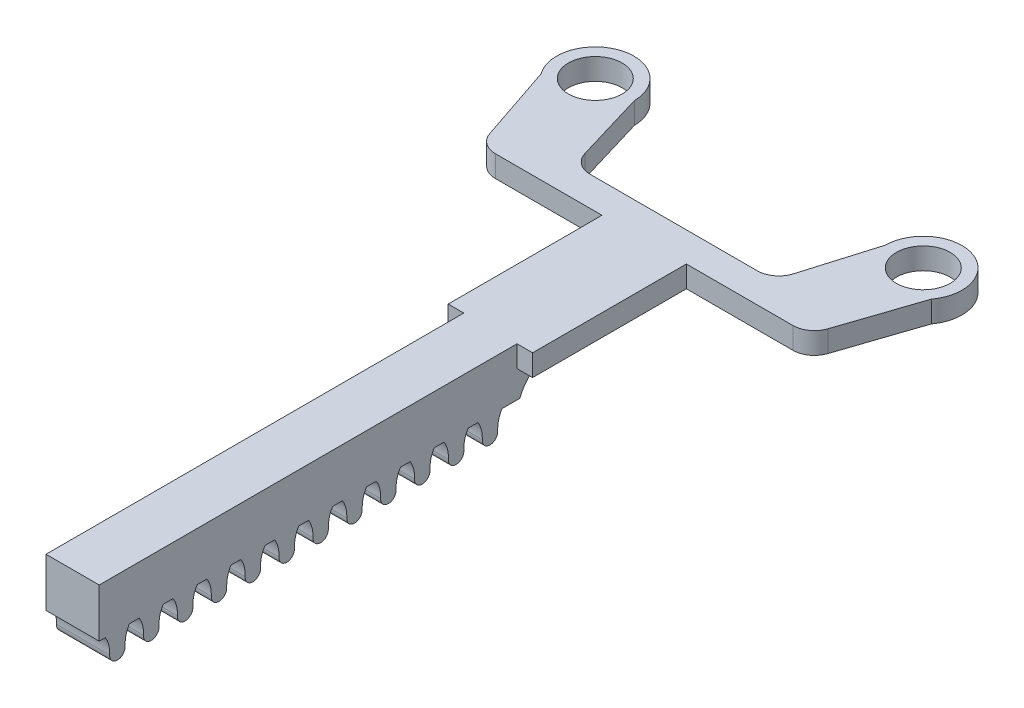
from build123d import *

# Parameters (mm, degrees)
SKETCH1_R           = 0.5
BOSS_EXTRUDE1_DEPTH = 0.4
SKETCH2_W           = 0.99
SKETCH2_H           = 7.77
BOSS_EXTRUDE2_DEPTH = 1
CUT_EXTRUDE1_DEPTH  = 1
SKETCH6_W           = 0.99
SKETCH6_H           = 0.8
BOSS_EXTRUDE3_DEPTH = 1
SKETCH7_R           = 0.809129623
CUT_EXTRUDE3_DEPTH  = 1
CUT_EXTRUDE4_DEPTH  = 1
CUT_EXTRUDE5_DEPTH  = 1


with BuildPart() as part:
    # Sketch1 → Boss-Extrude1 (new body)
    # profile 1 of 2: a face of its own
    with BuildSketch(Plane(origin=(0, 0, 0), x_dir=(1, 0, 0), z_dir=(0, 1, 0))):
        with BuildLine():
            Line((0.495, 0), (0.495, -7.77))
            Line((0.495, -7.77), (0.99, -7.77))
            Line((0.99, -7.77), (0.99, 0))
            Line((0.99, 0), (1.28, 0))
            Line((1.28, 0), (1.28, 2.86))
            Line((1.28, 2.86), (3.26, 2.86))
            ThreePointArc((3.26, 2.86), (3.493401063, 2.935155509), (3.639095249, 3.132380282))
            Line((3.639095249, 3.132380282), (4.124050177, 4.572942227))
            ThreePointArc((4.124050177, 4.572942227), (3.773991754, 5.683797022), (2.825140446, 5.008356078))
            Line((2.825140446, 5.008356078), (2.433289117, 3.695590853))
            ThreePointArc((2.433289117, 3.695590853), (2.288994081, 3.489248025), (2.05, 3.41))
            Line((2.05, 3.41), (1.28, 3.41))
            Line((1.28, 3.41), (0.495, 3.41))
            Line((0.495, 3.41), (0.495, 2.86))
            Line((0.495, 2.86), (0.495, 0))
        make_face()
        with Locations(Location((3.545140446, 5.001096664, 0), (0, 0, 270))):
            Circle(SKETCH1_R, mode=Mode.SUBTRACT)
    # profile 2 of 2: a face of its own
    with BuildSketch(Plane(origin=(0, 0, 0), x_dir=(1, 0, 0), z_dir=(0, 1, 0))):
        with BuildLine():
            Line((-2.27, 2.86), (-0.29, 2.86))
            Line((-0.29, 2.86), (-0.29, 0))
            Line((-0.29, 0), (0, 0))
            Line((0, 0), (0, -7.77))
            Line((0, -7.77), (0.495, -7.77))
            Line((0.495, -7.77), (0.495, 0))
            Line((0.495, 0), (0.495, 2.86))
            Line((0.495, 2.86), (0.495, 3.41))
            Line((0.495, 3.41), (-0.29, 3.41))
            Line((-0.29, 3.41), (-1.06, 3.41))
            ThreePointArc((-1.06, 3.41), (-1.298994081, 3.489248025), (-1.443289117, 3.695590853))
            Line((-1.443289117, 3.695590853), (-1.835140446, 5.008356078))
            ThreePointArc((-1.835140446, 5.008356078), (-2.783991754, 5.683797022), (-3.134050177, 4.572942227))
            Line((-3.134050177, 4.572942227), (-2.649095249, 3.132380282))
            ThreePointArc((-2.649095249, 3.132380282), (-2.503401063, 2.935155509), (-2.27, 2.86))
        make_face()
        with Locations(Location((-2.555140446, 5.001096664, 0), (0, 0, 270))):
            Circle(SKETCH1_R, mode=Mode.SUBTRACT)
    extrude(amount=BOSS_EXTRUDE1_DEPTH)

    # Sketch2 → Boss-Extrude2 (add)
    with BuildSketch(Plane.XZ):
        with Locations((0.495, 3.885)):
            Rectangle(SKETCH2_W, SKETCH2_H)
    extrude(amount=BOSS_EXTRUDE2_DEPTH)

    # Sketch5 → Cut-Extrude1 (cut)
    with BuildSketch(Plane.ZY):
        with BuildLine():
            ThreePointArc((7.575547609, -0.835332211), (7.432352405, -0.978527415), (7.289157201, -0.835332211))
            Line((7.289157201, -0.835332211), (7.289157201, -0.771041274))
            add(Edge.make_bspline(
                [(7.289157201, -0.771041274), (7.282098778, -0.622016662), (7.208094318, -0.505412251)],
                knots=[0.13405431, 0.13405431, 0.13405431, 0.769777422, 0.769777422, 0.769777422], degree=2))
            Line((7.208094318, -0.505412251), (7.150068787, -0.505412251))
            Line((7.150068787, -0.505412251), (7.026610492, -0.505412251))
            add(Edge.make_bspline(
                [(6.945136285, -0.824486473), (6.939585005, -0.642533117), (7.026610492, -0.505412251)],
                knots=[0.022199322, 0.022199322, 0.022199322, 0.769777422, 0.769777422, 0.769777422], degree=2))
            ThreePointArc((6.945136285, -0.824486473), (6.945444741, -0.829905444), (6.945547609, -0.835332211))
            ThreePointArc((6.945547609, -0.835332211), (6.802352405, -0.978527415), (6.659157201, -0.835332211))
            ThreePointArc((6.659157201, -0.835332211), (6.659260069, -0.829905444), (6.659568525, -0.824486473))
            add(Edge.make_bspline(
                [(6.659568525, -0.824486473), (6.665119805, -0.642533117), (6.578094318, -0.505412251)],
                knots=[0.022199322, 0.022199322, 0.022199322, 0.769777422, 0.769777422, 0.769777422], degree=2))
            Line((6.578094318, -0.505412251), (6.520068787, -0.505412251))
            Line((6.520068787, -0.505412251), (6.454636023, -0.505412251))
            Line((6.454636023, -0.505412251), (6.396610492, -0.505412251))
            add(Edge.make_bspline(
                [(6.315136285, -0.824486473), (6.309585005, -0.642533117), (6.396610492, -0.505412251)],
                knots=[0.022199322, 0.022199322, 0.022199322, 0.769777422, 0.769777422, 0.769777422], degree=2))
            ThreePointArc((6.315136285, -0.824486473), (6.315444741, -0.829905444), (6.315547609, -0.835332211))
            ThreePointArc((6.315547609, -0.835332211), (6.172352405, -0.978527415), (6.029157201, -0.835332211))
            ThreePointArc((6.029157201, -0.835332211), (6.029260069, -0.829905444), (6.029568525, -0.824486473))
            add(Edge.make_bspline(
                [(6.029568525, -0.824486473), (6.035119805, -0.642533117), (5.948094318, -0.505412251)],
                knots=[0.022199322, 0.022199322, 0.022199322, 0.769777422, 0.769777422, 0.769777422], degree=2))
            Line((5.948094318, -0.505412251), (5.890068787, -0.505412251))
            Line((5.890068787, -0.505412251), (5.824636023, -0.505412251))
            Line((5.824636023, -0.505412251), (5.766610492, -0.505412251))
            add(Edge.make_bspline(
                [(5.685136285, -0.824486473), (5.679585005, -0.642533117), (5.766610492, -0.505412251)],
                knots=[0.022199322, 0.022199322, 0.022199322, 0.769777422, 0.769777422, 0.769777422], degree=2))
            ThreePointArc((5.685136285, -0.824486473), (5.685444741, -0.829905444), (5.685547609, -0.835332211))
            ThreePointArc((5.685547609, -0.835332211), (5.542352405, -0.978527415), (5.399157201, -0.835332211))
            ThreePointArc((5.399157201, -0.835332211), (5.399260069, -0.829905444), (5.399568525, -0.824486473))
            add(Edge.make_bspline(
                [(5.399568525, -0.824486473), (5.405119805, -0.642533117), (5.318094318, -0.505412251)],
                knots=[0.022199322, 0.022199322, 0.022199322, 0.769777422, 0.769777422, 0.769777422], degree=2))
            Line((5.318094318, -0.505412251), (5.260068787, -0.505412251))
            Line((5.260068787, -0.505412251), (5.194636023, -0.505412251))
            Line((5.194636023, -0.505412251), (5.136610492, -0.505412251))
            add(Edge.make_bspline(
                [(5.055136285, -0.824486473), (5.049585005, -0.642533117), (5.136610492, -0.505412251)],
                knots=[0.022199322, 0.022199322, 0.022199322, 0.769777422, 0.769777422, 0.769777422], degree=2))
            ThreePointArc((5.055136285, -0.824486473), (5.055444741, -0.829905444), (5.055547609, -0.835332211))
            ThreePointArc((5.055547609, -0.835332211), (4.912352405, -0.978527415), (4.769157201, -0.835332211))
            ThreePointArc((4.769157201, -0.835332211), (4.769260069, -0.829905444), (4.769568525, -0.824486473))
            add(Edge.make_bspline(
                [(4.769568525, -0.824486473), (4.775119805, -0.642533117), (4.688094318, -0.505412251)],
                knots=[0.022199322, 0.022199322, 0.022199322, 0.769777422, 0.769777422, 0.769777422], degree=2))
            Line((4.688094318, -0.505412251), (4.630068787, -0.505412251))
            Line((4.630068787, -0.505412251), (4.564636023, -0.505412251))
            Line((4.564636023, -0.505412251), (4.506610492, -0.505412251))
            add(Edge.make_bspline(
                [(4.425136285, -0.824486473), (4.419585005, -0.642533117), (4.506610492, -0.505412251)],
                knots=[0.022199322, 0.022199322, 0.022199322, 0.769777422, 0.769777422, 0.769777422], degree=2))
            ThreePointArc((4.425136285, -0.824486473), (4.425444741, -0.829905444), (4.425547609, -0.835332211))
            ThreePointArc((4.425547609, -0.835332211), (4.282352405, -0.978527415), (4.139157201, -0.835332211))
            ThreePointArc((4.139157201, -0.835332211), (4.139260069, -0.829905444), (4.139568525, -0.824486473))
            add(Edge.make_bspline(
                [(4.139568525, -0.824486473), (4.145119805, -0.642533117), (4.058094318, -0.505412251)],
                knots=[0.022199322, 0.022199322, 0.022199322, 0.769777422, 0.769777422, 0.769777422], degree=2))
            Line((4.058094318, -0.505412251), (4.000068787, -0.505412251))
            Line((4.000068787, -0.505412251), (3.934636023, -0.505412251))
            Line((3.934636023, -0.505412251), (3.876610492, -0.505412251))
            add(Edge.make_bspline(
                [(3.795136285, -0.824486473), (3.789585005, -0.642533117), (3.876610492, -0.505412251)],
                knots=[0.022199322, 0.022199322, 0.022199322, 0.769777422, 0.769777422, 0.769777422], degree=2))
            ThreePointArc((3.795136285, -0.824486473), (3.795444741, -0.829905444), (3.795547609, -0.835332211))
            ThreePointArc((3.795547609, -0.835332211), (3.652352405, -0.978527415), (3.509157201, -0.835332211))
            ThreePointArc((3.509157201, -0.835332211), (3.509260069, -0.829905444), (3.509568525, -0.824486473))
            add(Edge.make_bspline(
                [(3.509568525, -0.824486473), (3.515119805, -0.642533117), (3.428094318, -0.505412251)],
                knots=[0.022199322, 0.022199322, 0.022199322, 0.769777422, 0.769777422, 0.769777422], degree=2))
            Line((3.428094318, -0.505412251), (3.370068787, -0.505412251))
            Line((3.370068787, -0.505412251), (3.304636023, -0.505412251))
            Line((3.304636023, -0.505412251), (3.246610492, -0.505412251))
            add(Edge.make_bspline(
                [(3.165136285, -0.824486473), (3.159585005, -0.642533117), (3.246610492, -0.505412251)],
                knots=[0.022199322, 0.022199322, 0.022199322, 0.769777422, 0.769777422, 0.769777422], degree=2))
            ThreePointArc((3.165136285, -0.824486473), (3.165444741, -0.829905444), (3.165547609, -0.835332211))
            ThreePointArc((3.165547609, -0.835332211), (3.022352405, -0.978527415), (2.879157201, -0.835332211))
            ThreePointArc((2.879157201, -0.835332211), (2.879260069, -0.829905444), (2.879568525, -0.824486473))
            add(Edge.make_bspline(
                [(2.879568525, -0.824486473), (2.885119805, -0.642533117), (2.798094318, -0.505412251)],
                knots=[0.022199322, 0.022199322, 0.022199322, 0.769777422, 0.769777422, 0.769777422], degree=2))
            Line((2.798094318, -0.505412251), (2.740068787, -0.505412251))
            Line((2.740068787, -0.505412251), (2.674636023, -0.505412251))
            Line((2.674636023, -0.505412251), (2.616610492, -0.505412251))
            add(Edge.make_bspline(
                [(2.535136285, -0.824486473), (2.529585005, -0.642533117), (2.616610492, -0.505412251)],
                knots=[0.022199322, 0.022199322, 0.022199322, 0.769777422, 0.769777422, 0.769777422], degree=2))
            ThreePointArc((2.535136285, -0.824486473), (2.535444741, -0.829905444), (2.535547609, -0.835332211))
            ThreePointArc((2.535547609, -0.835332211), (2.392352405, -0.978527415), (2.249157201, -0.835332211))
            ThreePointArc((2.249157201, -0.835332211), (2.249260069, -0.829905444), (2.249568525, -0.824486473))
            add(Edge.make_bspline(
                [(2.249568525, -0.824486473), (2.255119805, -0.642533117), (2.168094318, -0.505412251)],
                knots=[0.022199322, 0.022199322, 0.022199322, 0.769777422, 0.769777422, 0.769777422], degree=2))
            Line((2.168094318, -0.505412251), (2.110068787, -0.505412251))
            Line((2.110068787, -0.505412251), (2.044636023, -0.505412251))
            Line((2.044636023, -0.505412251), (1.986610492, -0.505412251))
            add(Edge.make_bspline(
                [(1.905136285, -0.824486473), (1.899585005, -0.642533117), (1.986610492, -0.505412251)],
                knots=[0.022199322, 0.022199322, 0.022199322, 0.769777422, 0.769777422, 0.769777422], degree=2))
            ThreePointArc((1.905136285, -0.824486473), (1.905444741, -0.829905444), (1.905547609, -0.835332211))
            ThreePointArc((1.905547609, -0.835332211), (1.762352405, -0.978527415), (1.619157201, -0.835332211))
            ThreePointArc((1.619157201, -0.835332211), (1.619260069, -0.829905444), (1.619568525, -0.824486473))
            add(Edge.make_bspline(
                [(1.619568525, -0.824486473), (1.625119805, -0.642533117), (1.538094318, -0.505412251)],
                knots=[0.022199322, 0.022199322, 0.022199322, 0.769777422, 0.769777422, 0.769777422], degree=2))
            Line((1.538094318, -0.505412251), (1.480068787, -0.505412251))
            Line((1.480068787, -0.505412251), (1.414636023, -0.505412251))
            Line((1.414636023, -0.505412251), (1.356610492, -0.505412251))
            add(Edge.make_bspline(
                [(1.275136285, -0.824486473), (1.269585005, -0.642533117), (1.356610492, -0.505412251)],
                knots=[0.022199322, 0.022199322, 0.022199322, 0.769777422, 0.769777422, 0.769777422], degree=2))
            ThreePointArc((1.275136285, -0.824486473), (1.275444741, -0.829905444), (1.275547609, -0.835332211))
            ThreePointArc((1.275547609, -0.835332211), (1.132352405, -0.978527415), (0.989157201, -0.835332211))
            ThreePointArc((0.989157201, -0.835332211), (0.989260069, -0.829905444), (0.989568525, -0.824486473))
            add(Edge.make_bspline(
                [(0.989568525, -0.824486473), (0.995119805, -0.642533117), (0.908094318, -0.505412251)],
                knots=[0.022199322, 0.022199322, 0.022199322, 0.769777422, 0.769777422, 0.769777422], degree=2))
            Line((0.908094318, -0.505412251), (0.850068787, -0.505412251))
            Line((0.850068787, -0.505412251), (0.784636023, -0.505412251))
            Line((0.784636023, -0.505412251), (0.726610492, -0.505412251))
            add(Edge.make_bspline(
                [(0.645136285, -0.824486473), (0.639585005, -0.642533117), (0.726610492, -0.505412251)],
                knots=[0.022199322, 0.022199322, 0.022199322, 0.769777422, 0.769777422, 0.769777422], degree=2))
            ThreePointArc((0.645136285, -0.824486473), (0.645444741, -0.829905444), (0.645547609, -0.835332211))
            ThreePointArc((0.645547609, -0.835332211), (0.502352405, -0.978527415), (0.359157201, -0.835332211))
            ThreePointArc((0.359157201, -0.835332211), (0.359260069, -0.829905444), (0.359568525, -0.824486473))
            add(Edge.make_bspline(
                [(0.359568525, -0.824486473), (0.365119805, -0.642533117), (0.278094318, -0.505412251)],
                knots=[0.022199322, 0.022199322, 0.022199322, 0.769777422, 0.769777422, 0.769777422], degree=2))
            Line((0.278094318, -0.505412251), (0.154636023, -0.505412251))
            Line((0.154636023, -0.505412251), (-0.098714184, -1.20159072))
            Line((-0.098714184, -1.20159072), (7.934168226, -1.20159072))
            Line((7.934168226, -1.20159072), (7.780068787, -0.505412251))
            Line((7.780068787, -0.505412251), (7.656610492, -0.505412251))
            add(Edge.make_bspline(
                [(7.575136285, -0.824486473), (7.569585005, -0.642533117), (7.656610492, -0.505412251)],
                knots=[0.022199322, 0.022199322, 0.022199322, 0.769777422, 0.769777422, 0.769777422], degree=2))
            ThreePointArc((7.575136285, -0.824486473), (7.575444741, -0.829905444), (7.575547609, -0.835332211))
        make_face()
    extrude(amount=-CUT_EXTRUDE1_DEPTH, mode=Mode.SUBTRACT)

    # Sketch6 → Boss-Extrude3 (add)
    with BuildSketch(Plane.XZ):
        with Locations((0.495, -0.4)):
            Rectangle(SKETCH6_W, SKETCH6_H)
    extrude(amount=BOSS_EXTRUDE3_DEPTH)

    # Sketch7 → Cut-Extrude3 (cut)
    with BuildSketch(Plane.ZY):
        with Locations((-0.8, -0.809129623)):
            Circle(SKETCH7_R)
    extrude(amount=-CUT_EXTRUDE3_DEPTH, mode=Mode.SUBTRACT)


with BuildPart() as cut_extrude3_piece_1:
    # of the separate pieces the step leaves, piece 1, a body of its own (cut_extrude3_pieces)
    add(part.part.solids().sort_by_distance((0.99, 0.4, 7.77))[0])

    # Sketch9 → Cut-Extrude5 (cut)
    with BuildSketch(Plane.ZY):
        Polygon((0.154636023, -0.505412251), (-0.050035664, -0.505412251), (0, -0.930335013), align=None)
    extrude(amount=-CUT_EXTRUDE5_DEPTH, mode=Mode.SUBTRACT)


with BuildPart() as cut_extrude3_piece_2:
    # of the separate pieces the step leaves, piece 2, a body of its own (cut_extrude3_pieces)
    add(part.part.solids().sort_by_distance((0, -1, 0))[0])

    # Sketch8 → Cut-Extrude4 (cut)
    with BuildSketch(Plane.ZY):
        Polygon((0, -1), (-0.01370537, -1), (0, -0.930335013), align=None)
    extrude(amount=-CUT_EXTRUDE4_DEPTH, mode=Mode.SUBTRACT)


solid = cut_extrude3_piece_1.part
